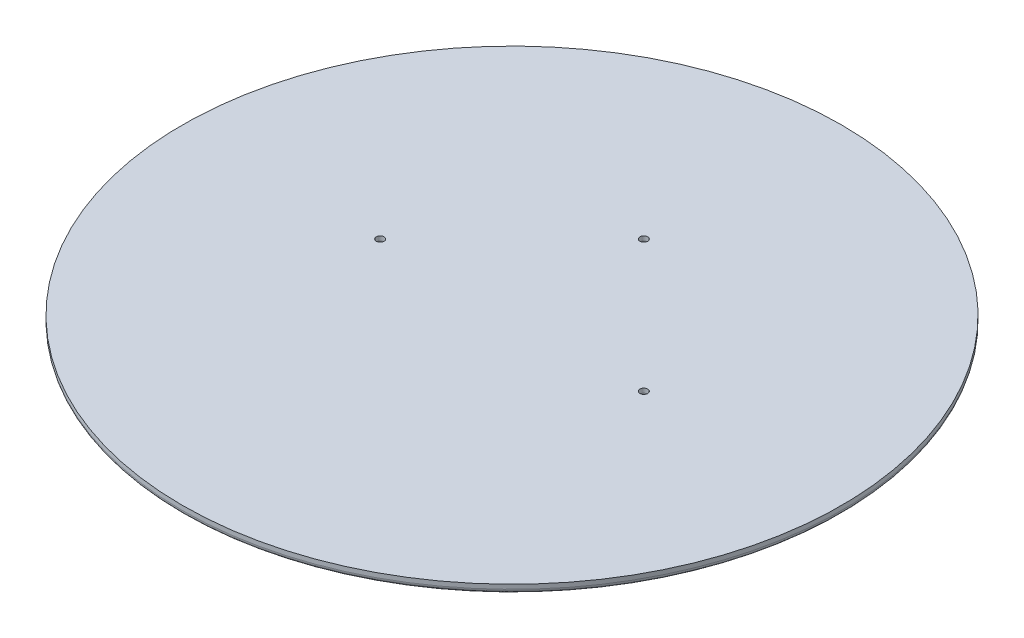
from build123d import *

# Parameters (mm, degrees)
SKETCH1_R           = 750
SKETCH1_R_2         = 8.89
BOSS_EXTRUDE1_DEPTH = 20
FILLET1_R           = 10
SKETCH3_R           = 5
BOSS_EXTRUDE2_DEPTH = 47


with BuildPart() as part:
    # Sketch1 → Boss-Extrude1 (new body)
    with BuildSketch(Plane(origin=(0, 0, 0), x_dir=(1, 0, 0), z_dir=(0, 1, 0))):
        with Locations(Location((0, 0, 0), (0, 0, 270))):
            Circle(SKETCH1_R)
        with Locations(Location((0, 300, 0), (0, 0, 270))):
            Circle(SKETCH1_R_2, mode=Mode.SUBTRACT)
        with Locations(Location((-300, 0, 0), (0, 0, 270))):
            Circle(SKETCH1_R_2, mode=Mode.SUBTRACT)
        with Locations(Location((300, 0, 0), (0, 0, 270))):
            Circle(SKETCH1_R_2, mode=Mode.SUBTRACT)
    extrude(amount=BOSS_EXTRUDE1_DEPTH)

    # Fillet1
    fillet1_edges = [part.edges().sort_by_distance(p)[0] for p in [
        (0, 0, -750),
        (-300, 0, -8.89),
        (300, 0, -8.89),
        (0, 0, -308.89),
    ]]
    fillet(fillet1_edges, radius=FILLET1_R)

    # Sketch3 → Boss-Extrude2 (add)
    with BuildSketch(Plane(origin=(0, 20, 0), x_dir=(1, 0, 0), z_dir=(0, 1, 0))):
        with Locations(Location((-325, 0, 0), (0, 0, 270))):
            Circle(SKETCH3_R)
        with Locations(Location((325, 0, 0), (0, 0, 270))):
            Circle(SKETCH3_R)
        with Locations(Location((0, 325, 0), (0, 0, 270))):
            Circle(SKETCH3_R)
    extrude(amount=-BOSS_EXTRUDE2_DEPTH)


solid = part.part
